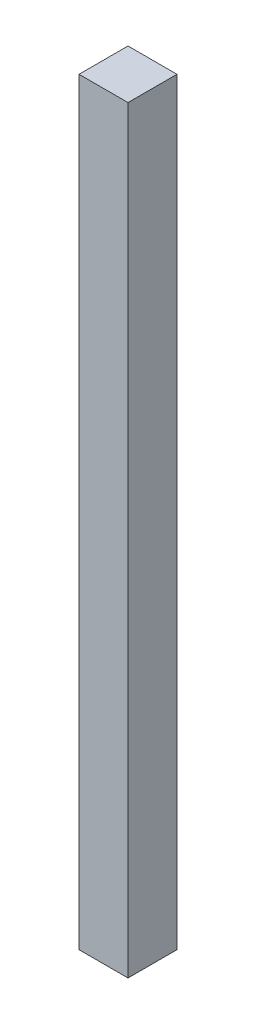
from build123d import *

# Parameters (mm, degrees)
SKETCH1_W           = 25.4
SKETCH1_H           = 25.4
BOSS_EXTRUDE1_DEPTH = 393.2


with BuildPart() as part:
    # Sketch1 → Boss-Extrude1 (new body)
    with BuildSketch(Plane(origin=(0, 0, 0), x_dir=(1, 0, 0), z_dir=(0, 1, 0))):
        with Locations((12.7, 12.7)):
            Rectangle(SKETCH1_W, SKETCH1_H)
    extrude(amount=BOSS_EXTRUDE1_DEPTH)


solid = part.part
